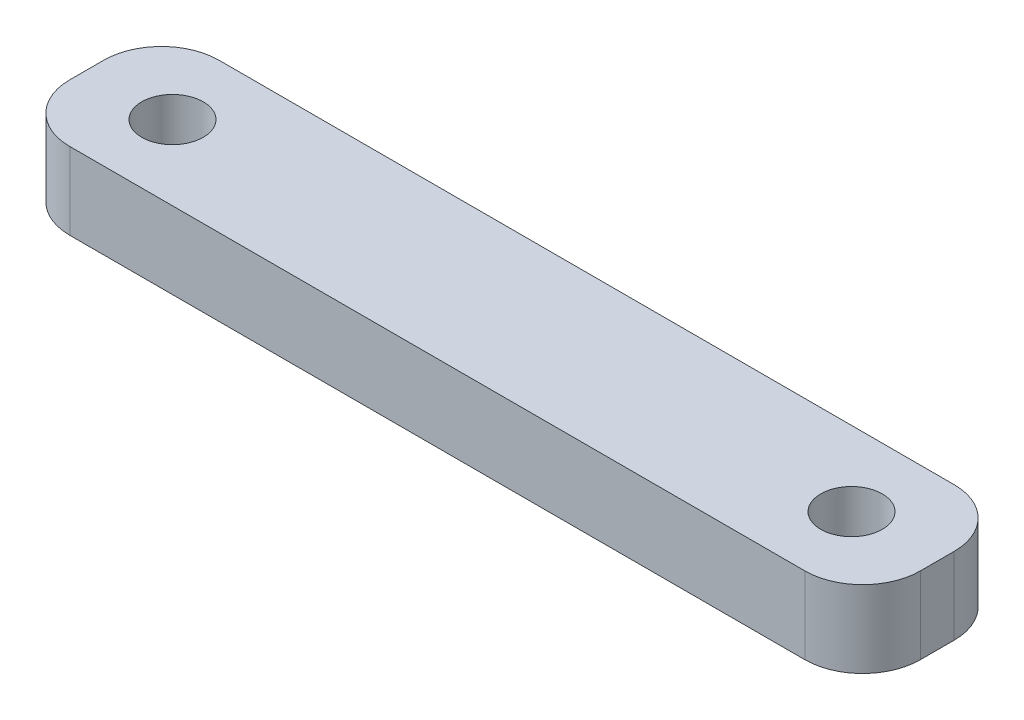
from build123d import *

# Parameters (mm, degrees)
SKETCH_1_W      = 44.217702276
SKETCH_1_H      = 7.762687128
SKETCH_1_R      = 1.6
EXTRUDE_1_DEPTH = 4
FILLET_1_R      = 3


with BuildPart() as part:
    # 草图1 → 凸台-拉伸1 (new body)
    with BuildSketch(Plane(origin=(0, 0, 0), x_dir=(1, 0, 0), z_dir=(0, 1, 0))):
        Rectangle(SKETCH_1_W, SKETCH_1_H)
        with Locations(Location((-17.65, 0, 0), (0, 0, 270))):
            Circle(SKETCH_1_R, mode=Mode.SUBTRACT)
        with Locations(Location((17.65, 0, 0), (0, 0, 90))):
            Circle(SKETCH_1_R, mode=Mode.SUBTRACT)
    extrude(amount=EXTRUDE_1_DEPTH)

    # 圆角1
    fillet_1_edges = [part.edges().sort_by_distance(p)[0] for p in [
        (-22.108851138, 2, -3.881343564),
        (22.108851138, 2, -3.881343564),
        (22.108851138, 2, 3.881343564),
        (-22.108851138, 2, 3.881343564),
    ]]
    fillet(fillet_1_edges, radius=FILLET_1_R)


solid = part.part
